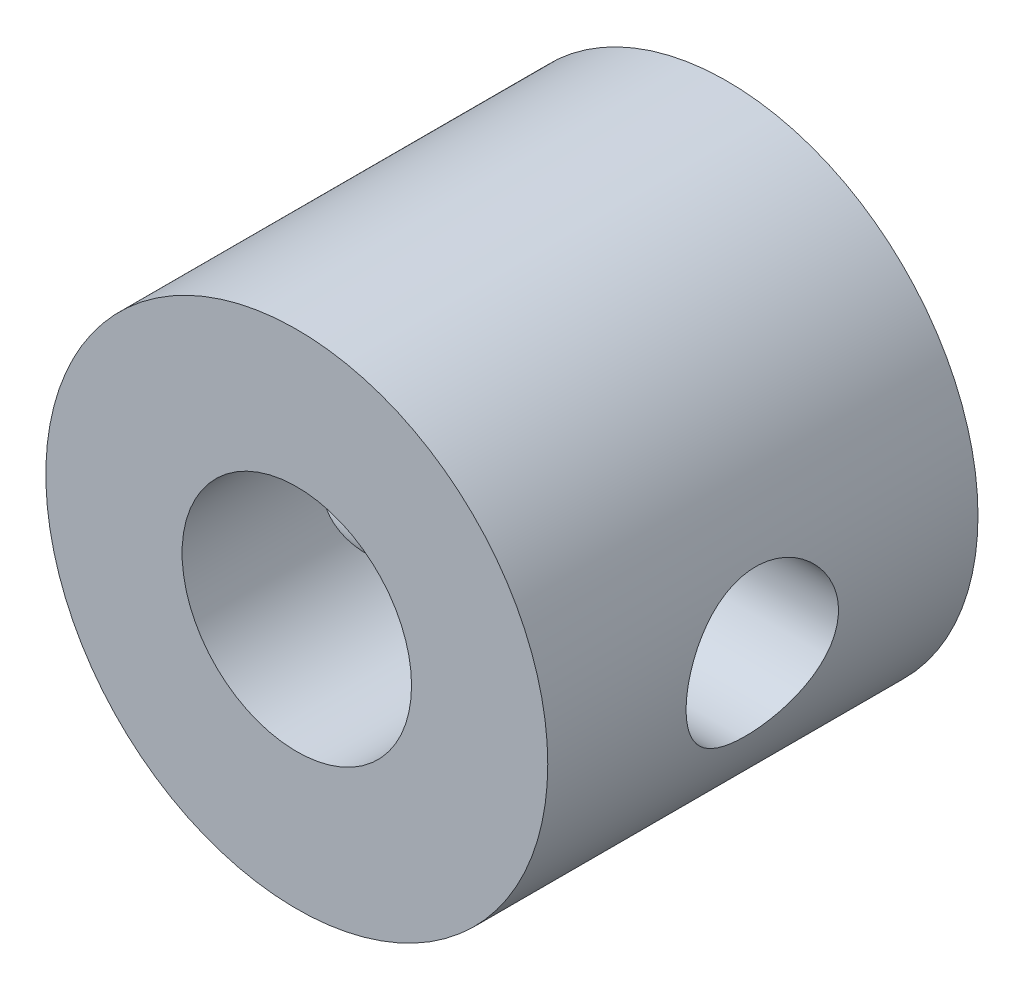
from build123d import *

# Parameters (mm, degrees)
SKETCH1_R               = 11.1125
SKETCH1_R_2             = 5.08
BOSS_EXTRUDE1_DEPTH     = 19.05
CUT_EXTRUDE3_DEPTH      = 25.695704333
CUT_EXTRUDE3_DEPTH_BACK = 25.695704333
SKETCH5_R               = 3.3655


with BuildPart() as part:
    # Sketch1 → Boss-Extrude1 (new body)
    with BuildSketch(Plane.XY):
        with Locations(Location((0, 0, 0), (0, 0, 180))):
            Circle(SKETCH1_R)
        with Locations(Location((0, 0, 0), (0, 0, 180))):
            Circle(SKETCH1_R_2, mode=Mode.SUBTRACT)
    extrude(amount=BOSS_EXTRUDE1_DEPTH)

    # Sketch5 → Cut-Extrude3 (cut, two sides: drawn at the far end of the back side and taken through both)
    with BuildSketch(Plane(origin=(0, 0, 0), x_dir=(0, 0, -1), z_dir=(1, 0, 0)).offset(-CUT_EXTRUDE3_DEPTH_BACK)):
        with Locations((-9.525, -0.714803546)):
            Circle(SKETCH5_R)
    extrude(amount=CUT_EXTRUDE3_DEPTH + CUT_EXTRUDE3_DEPTH_BACK, mode=Mode.SUBTRACT)


solid = part.part
